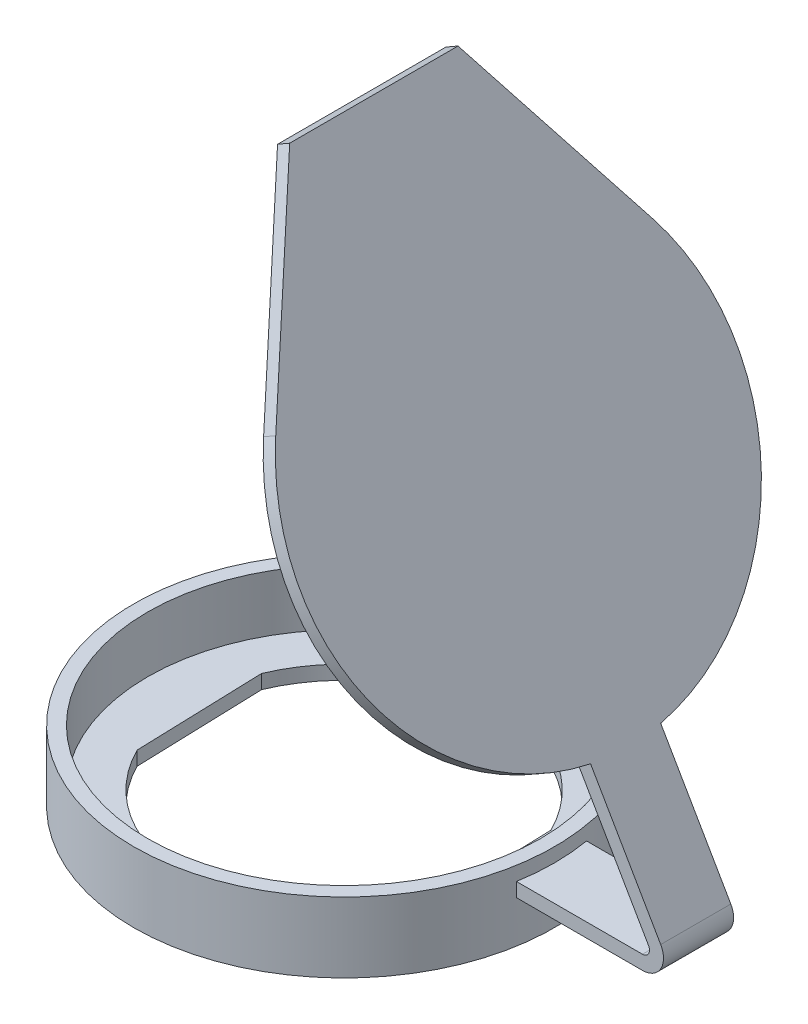
from build123d import *

# Parameters (mm, degrees)
SKETCH_1_R          = 15
EXTRUDE_1_DEPTH     = 5
SHELL_1_T           = -1
CUT_EXTRUDE_1_DEPTH = 5
EXTRUDE_2_DEPTH     = 1
EXTRUDE_3_DEPTH     = 2.5
EXTRUDE_6_DEPTH     = 1
SKETCH_6_R          = 14
SKETCH_6_R_2        = 12.5
EXTRUDE_7_DEPTH     = 1.5


with BuildPart() as part:
    # 草图1 → 凸台-拉伸1 (new body)
    with BuildSketch(Plane(origin=(0, 0, 0), x_dir=(1, 0, 0), z_dir=(0, 1, 0))):
        with Locations(Location((0, 0, 0), (0, 0, 270))):
            Circle(SKETCH_1_R)
    extrude(amount=EXTRUDE_1_DEPTH)

    # 抽壳1
    shell_1_openings = [part.faces().sort_by_distance(p)[0] for p in [
        (0, 5, 0),
    ]]
    offset(amount=SHELL_1_T, openings=shell_1_openings, kind=Kind.INTERSECTION)

    # 草图2 → 切除-拉伸1 (cut)
    with BuildSketch(Plane(origin=(0, 1, 0), x_dir=(1, 0, 0), z_dir=(0, 1, 0))):
        with BuildLine():
            Line((-10.141362356, 4.260606713), (-9.848418855, -4.89986184))
            ThreePointArc((-9.848418855, -4.89986184), (-7.525588518, -8.022812316), (-4.260606713, -10.141362356))
            Line((-4.260606713, -10.141362356), (4.89986184, -9.848418855))
            ThreePointArc((4.89986184, -9.848418855), (8.022812316, -7.525588518), (10.141362356, -4.260606713))
            Line((10.141362356, -4.260606713), (9.848418855, 4.89986184))
            ThreePointArc((9.848418855, 4.89986184), (7.525588518, 8.022812316), (4.260606713, 10.141362356))
            Line((4.260606713, 10.141362356), (-4.89986184, 9.848418855))
            ThreePointArc((-4.89986184, 9.848418855), (-8.022812316, 7.525588518), (-10.141362356, 4.260606713))
        make_face()
    extrude(amount=-CUT_EXTRUDE_1_DEPTH, mode=Mode.SUBTRACT)

    # 草图3 → 凸台-拉伸2 (add)
    with BuildSketch(Plane(origin=(0, 3, 0), x_dir=(-1, 0, 0), z_dir=(0, -1, 0))):
        with BuildLine():
            Line((-14.790199458, 2.5), (-23.774977314, 2.5))
            Line((-23.774977314, 2.5), (-23.774977314, -2.5))
            Line((-23.774977314, -2.5), (-14.790199458, -2.5))
            ThreePointArc((-14.790199458, -2.5), (-15, 0), (-14.790199458, 2.5))
        make_face()
    extrude(amount=-EXTRUDE_2_DEPTH)

    # 草图4 → 凸台-拉伸3 (add, symmetric)
    with BuildSketch(Plane.XY):
        with BuildLine():
            Line((20.07401542, 13.910254038), (19.207990016, 13.410254038))
            Line((19.207990016, 13.410254038), (24.207990016, 4.75))
            ThreePointArc((24.207990016, 4.75), (24.207990016, 4.25), (23.774977314, 4))
            Line((23.774977314, 4), (23.774977314, 3))
            ThreePointArc((23.774977314, 3), (25.07401542, 3.75), (25.07401542, 5.25))
            Line((25.07401542, 5.25), (20.07401542, 13.910254038))
        make_face()
    extrude(amount=EXTRUDE_3_DEPTH, both=True)

    # 草图5 → 凸台-拉伸6 (add)
    with BuildSketch(Plane(origin=(21.07882825, 12.169867164, 0), x_dir=(0, 0, 1), z_dir=(-0.8660254037844399, -0.49999999999999806, 0))):
        with BuildLine():
            Line((6, 37.914379355), (-6, 37.914379355))
            Line((-6, 37.914379355), (-13.423393759, 25.056684201))
            ThreePointArc((-13.423393759, 25.056684201), (0, 1.806684201), (13.423393759, 25.056684201))
            Line((13.423393759, 25.056684201), (6, 37.914379355))
        make_face()
    extrude(amount=EXTRUDE_6_DEPTH)

    # 草图6 → 凸台-拉伸7 (add)
    with BuildSketch(Plane(origin=(20.212802846, 11.669867164, 0), x_dir=(0, 0, 1), z_dir=(-0.86602540378444, -0.4999999999999978, 0))):
        with Locations(Location((0, 17.306684201, 0), (0, 0, 90))):
            Circle(SKETCH_6_R)
        with Locations(Location((0, 17.306684201, 0), (0, 0, 270))):
            Circle(SKETCH_6_R_2, mode=Mode.SUBTRACT)
    extrude(amount=EXTRUDE_7_DEPTH)


solid = part.part
